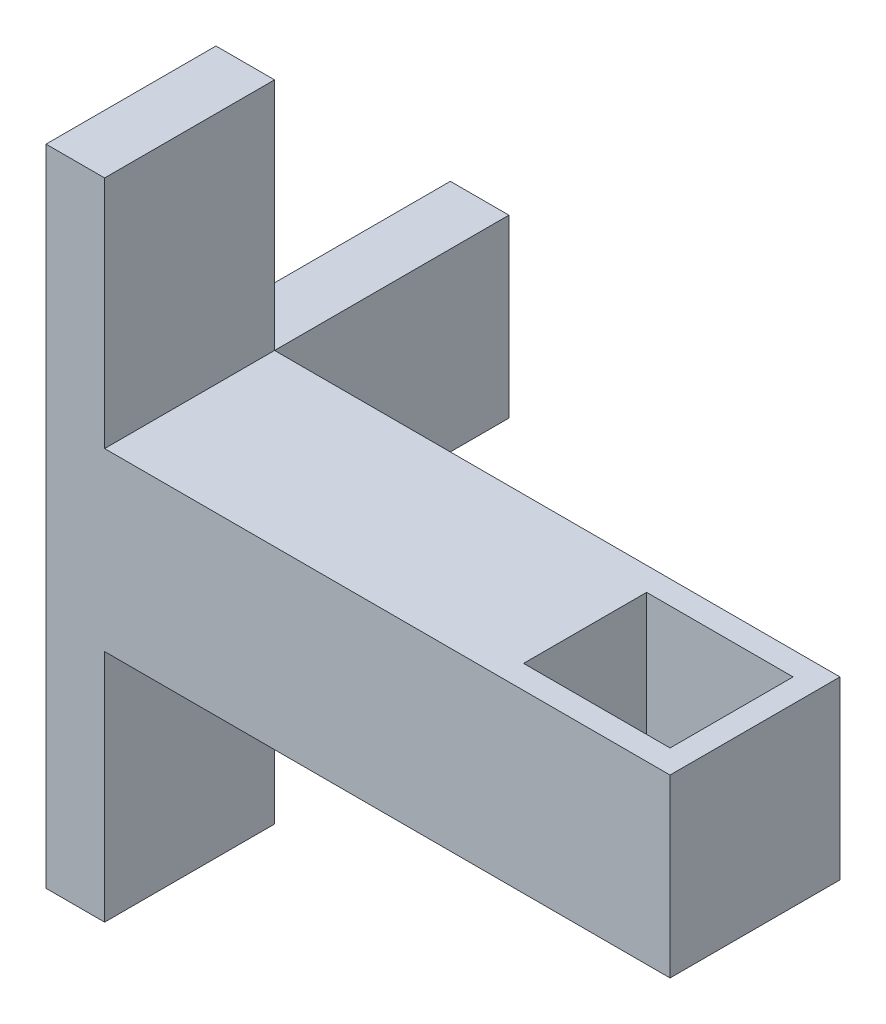
from build123d import *

# Parameters (mm, degrees)
SKETCH1_W           = 12.5
SKETCH1_H           = 10.5
BOSS_EXTRUDE2_DEPTH = 15
BOSS_EXTRUDE3_DEPTH = 5


with BuildPart() as part:
    # Sketch1 → Boss-Extrude2 (new body)
    with BuildSketch(Plane(origin=(0, 0, 0), x_dir=(1, 0, 0), z_dir=(0, 1, 0))):
        Polygon((-36.75, -12.5), (-2, -12.5), (14.5, -12.5), (14.5, 2), (-2, 2), (-33.75, 2), (-33.75, 22), (-38.75, 22), (-38.75, -12.5), align=None)
        with Locations((6.25, -5.25)):
            Rectangle(SKETCH1_W, SKETCH1_H, mode=Mode.SUBTRACT)
    extrude(amount=BOSS_EXTRUDE2_DEPTH)

    # Sketch3 → Boss-Extrude3 (add)
    with BuildSketch(Plane(origin=(-33.75, 0, 0), x_dir=(0, 0, -1), z_dir=(1, 0, 0))):
        Polygon((2, 15), (2, 35), (-12.5, 35), (-12.5, -20), (2, -20), align=None)
    extrude(amount=-BOSS_EXTRUDE3_DEPTH)


solid = part.part
